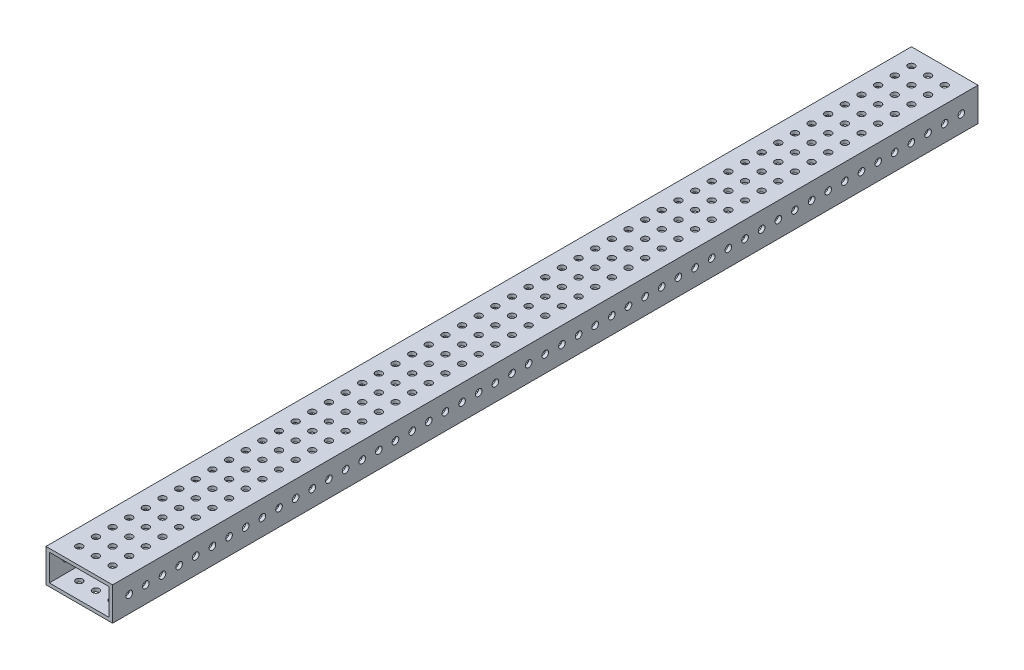
from build123d import *

# Parameters (mm, degrees)
SKETCH1_W           = 50.8
SKETCH1_H           = 25.4
SKETCH1_W_2         = 45.72
SKETCH1_H_2         = 20.32
BOSS_EXTRUDE1_DEPTH = 660.4
SKETCH2_R           = 2.54
CUT_EXTRUDE1_DEPTH  = 50.8
SKETCH3_R           = 2.54
CUT_EXTRUDE2_DEPTH  = 25.4


with BuildPart() as part:
    # Sketch1 → Boss-Extrude1 (new body)
    with BuildSketch(Plane.XY):
        with Locations((6.087936508, -2.60047619)):
            Rectangle(SKETCH1_W, SKETCH1_H)
        with Locations((6.087936508, -2.60047619)):
            Rectangle(SKETCH1_W_2, SKETCH1_H_2, mode=Mode.SUBTRACT)
    extrude(amount=BOSS_EXTRUDE1_DEPTH)

    # Sketch2 → Cut-Extrude1 (cut)
    with BuildSketch(Plane(origin=(31.487936508, 0, 0), x_dir=(0, 0, -1), z_dir=(1, 0, 0))):
        with Locations(Location((-647.7, -2.60047619, 0), (0, 0, 90))):
            Circle(SKETCH2_R)
        with Locations(Location((-635, -2.60047619, 0), (0, 0, 90))):
            Circle(SKETCH2_R)
        with Locations(Location((-622.3, -2.60047619, 0), (0, 0, 90))):
            Circle(SKETCH2_R)
        with Locations(Location((-609.6, -2.60047619, 0), (0, 0, 90))):
            Circle(SKETCH2_R)
        with Locations(Location((-596.9, -2.60047619, 0), (0, 0, 90))):
            Circle(SKETCH2_R)
        with Locations(Location((-584.2, -2.60047619, 0), (0, 0, 90))):
            Circle(SKETCH2_R)
        with Locations(Location((-571.5, -2.60047619, 0), (0, 0, 90))):
            Circle(SKETCH2_R)
        with Locations(Location((-558.8, -2.60047619, 0), (0, 0, 90))):
            Circle(SKETCH2_R)
        with Locations(Location((-546.1, -2.60047619, 0), (0, 0, 90))):
            Circle(SKETCH2_R)
        with Locations(Location((-533.4, -2.60047619, 0), (0, 0, 90))):
            Circle(SKETCH2_R)
        with Locations(Location((-520.7, -2.60047619, 0), (0, 0, 90))):
            Circle(SKETCH2_R)
        with Locations(Location((-508, -2.60047619, 0), (0, 0, 90))):
            Circle(SKETCH2_R)
        with Locations(Location((-495.3, -2.60047619, 0), (0, 0, 90))):
            Circle(SKETCH2_R)
        with Locations(Location((-482.6, -2.60047619, 0), (0, 0, 90))):
            Circle(SKETCH2_R)
        with Locations(Location((-469.9, -2.60047619, 0), (0, 0, 90))):
            Circle(SKETCH2_R)
        with Locations(Location((-457.2, -2.60047619, 0), (0, 0, 90))):
            Circle(SKETCH2_R)
        with Locations(Location((-444.5, -2.60047619, 0), (0, 0, 90))):
            Circle(SKETCH2_R)
        with Locations(Location((-431.8, -2.60047619, 0), (0, 0, 90))):
            Circle(SKETCH2_R)
        with Locations(Location((-419.1, -2.60047619, 0), (0, 0, 90))):
            Circle(SKETCH2_R)
        with Locations(Location((-406.4, -2.60047619, 0), (0, 0, 90))):
            Circle(SKETCH2_R)
        with Locations(Location((-393.7, -2.60047619, 0), (0, 0, 90))):
            Circle(SKETCH2_R)
        with Locations(Location((-381, -2.60047619, 0), (0, 0, 90))):
            Circle(SKETCH2_R)
        with Locations(Location((-368.3, -2.60047619, 0), (0, 0, 90))):
            Circle(SKETCH2_R)
        with Locations(Location((-355.6, -2.60047619, 0), (0, 0, 90))):
            Circle(SKETCH2_R)
        with Locations(Location((-342.9, -2.60047619, 0), (0, 0, 90))):
            Circle(SKETCH2_R)
        with Locations(Location((-330.2, -2.60047619, 0), (0, 0, 90))):
            Circle(SKETCH2_R)
        with Locations(Location((-317.5, -2.60047619, 0), (0, 0, 90))):
            Circle(SKETCH2_R)
        with Locations(Location((-304.8, -2.60047619, 0), (0, 0, 90))):
            Circle(SKETCH2_R)
        with Locations(Location((-292.1, -2.60047619, 0), (0, 0, 90))):
            Circle(SKETCH2_R)
        with Locations(Location((-279.4, -2.60047619, 0), (0, 0, 90))):
            Circle(SKETCH2_R)
        with Locations(Location((-266.7, -2.60047619, 0), (0, 0, 90))):
            Circle(SKETCH2_R)
        with Locations(Location((-254, -2.60047619, 0), (0, 0, 90))):
            Circle(SKETCH2_R)
        with Locations(Location((-241.3, -2.60047619, 0), (0, 0, 90))):
            Circle(SKETCH2_R)
        with Locations(Location((-228.6, -2.60047619, 0), (0, 0, 90))):
            Circle(SKETCH2_R)
        with Locations(Location((-215.9, -2.60047619, 0), (0, 0, 90))):
            Circle(SKETCH2_R)
        with Locations(Location((-203.2, -2.60047619, 0), (0, 0, 90))):
            Circle(SKETCH2_R)
        with Locations(Location((-190.5, -2.60047619, 0), (0, 0, 90))):
            Circle(SKETCH2_R)
        with Locations(Location((-177.8, -2.60047619, 0), (0, 0, 90))):
            Circle(SKETCH2_R)
        with Locations(Location((-165.1, -2.60047619, 0), (0, 0, 90))):
            Circle(SKETCH2_R)
        with Locations(Location((-152.4, -2.60047619, 0), (0, 0, 90))):
            Circle(SKETCH2_R)
        with Locations(Location((-139.7, -2.60047619, 0), (0, 0, 90))):
            Circle(SKETCH2_R)
        with Locations(Location((-127, -2.60047619, 0), (0, 0, 90))):
            Circle(SKETCH2_R)
        with Locations(Location((-114.3, -2.60047619, 0), (0, 0, 90))):
            Circle(SKETCH2_R)
        with Locations(Location((-101.6, -2.60047619, 0), (0, 0, 90))):
            Circle(SKETCH2_R)
        with Locations(Location((-88.9, -2.60047619, 0), (0, 0, 90))):
            Circle(SKETCH2_R)
        with Locations(Location((-76.2, -2.60047619, 0), (0, 0, 90))):
            Circle(SKETCH2_R)
        with Locations(Location((-63.5, -2.60047619, 0), (0, 0, 90))):
            Circle(SKETCH2_R)
        with Locations(Location((-50.8, -2.60047619, 0), (0, 0, 90))):
            Circle(SKETCH2_R)
        with Locations(Location((-38.1, -2.60047619, 0), (0, 0, 90))):
            Circle(SKETCH2_R)
        with Locations(Location((-25.4, -2.60047619, 0), (0, 0, 90))):
            Circle(SKETCH2_R)
        with Locations(Location((-12.7, -2.60047619, 0), (0, 0, 90))):
            Circle(SKETCH2_R)
    extrude(amount=-CUT_EXTRUDE1_DEPTH, mode=Mode.SUBTRACT)

    # Sketch3 → Cut-Extrude2 (cut)
    with BuildSketch(Plane(origin=(0, 10.09952381, 0), x_dir=(1, 0, 0), z_dir=(0, 1, 0))):
        with Locations(Location((-6.612063492, -647.7, 0), (0, 0, 270))):
            Circle(SKETCH3_R)
        with Locations(Location((6.087936508, -647.7, 0), (0, 0, 270))):
            Circle(SKETCH3_R)
        with Locations(Location((18.787936508, -647.7, 0), (0, 0, 270))):
            Circle(SKETCH3_R)
        with Locations(Location((6.087936508, -635, 0), (0, 0, 270))):
            Circle(SKETCH3_R)
        with Locations(Location((18.787936508, -635, 0), (0, 0, 270))):
            Circle(SKETCH3_R)
        with Locations(Location((6.087936508, -622.3, 0), (0, 0, 270))):
            Circle(SKETCH3_R)
        with Locations(Location((18.787936508, -622.3, 0), (0, 0, 270))):
            Circle(SKETCH3_R)
        with Locations(Location((6.087936508, -609.6, 0), (0, 0, 270))):
            Circle(SKETCH3_R)
        with Locations(Location((18.787936508, -609.6, 0), (0, 0, 270))):
            Circle(SKETCH3_R)
        with Locations(Location((6.087936508, -596.9, 0), (0, 0, 270))):
            Circle(SKETCH3_R)
        with Locations(Location((18.787936508, -596.9, 0), (0, 0, 270))):
            Circle(SKETCH3_R)
        with Locations(Location((6.087936508, -584.2, 0), (0, 0, 270))):
            Circle(SKETCH3_R)
        with Locations(Location((18.787936508, -584.2, 0), (0, 0, 270))):
            Circle(SKETCH3_R)
        with Locations(Location((6.087936508, -571.5, 0), (0, 0, 270))):
            Circle(SKETCH3_R)
        with Locations(Location((18.787936508, -571.5, 0), (0, 0, 270))):
            Circle(SKETCH3_R)
        with Locations(Location((6.087936508, -558.8, 0), (0, 0, 270))):
            Circle(SKETCH3_R)
        with Locations(Location((18.787936508, -558.8, 0), (0, 0, 270))):
            Circle(SKETCH3_R)
        with Locations(Location((6.087936508, -546.1, 0), (0, 0, 270))):
            Circle(SKETCH3_R)
        with Locations(Location((18.787936508, -546.1, 0), (0, 0, 270))):
            Circle(SKETCH3_R)
        with Locations(Location((6.087936508, -533.4, 0), (0, 0, 270))):
            Circle(SKETCH3_R)
        with Locations(Location((18.787936508, -533.4, 0), (0, 0, 270))):
            Circle(SKETCH3_R)
        with Locations(Location((6.087936508, -520.7, 0), (0, 0, 270))):
            Circle(SKETCH3_R)
        with Locations(Location((18.787936508, -520.7, 0), (0, 0, 270))):
            Circle(SKETCH3_R)
        with Locations(Location((6.087936508, -508, 0), (0, 0, 270))):
            Circle(SKETCH3_R)
        with Locations(Location((18.787936508, -508, 0), (0, 0, 270))):
            Circle(SKETCH3_R)
        with Locations(Location((6.087936508, -495.3, 0), (0, 0, 270))):
            Circle(SKETCH3_R)
        with Locations(Location((18.787936508, -495.3, 0), (0, 0, 270))):
            Circle(SKETCH3_R)
        with Locations(Location((6.087936508, -482.6, 0), (0, 0, 270))):
            Circle(SKETCH3_R)
        with Locations(Location((18.787936508, -482.6, 0), (0, 0, 270))):
            Circle(SKETCH3_R)
        with Locations(Location((6.087936508, -469.9, 0), (0, 0, 270))):
            Circle(SKETCH3_R)
        with Locations(Location((18.787936508, -469.9, 0), (0, 0, 270))):
            Circle(SKETCH3_R)
        with Locations(Location((6.087936508, -457.2, 0), (0, 0, 270))):
            Circle(SKETCH3_R)
        with Locations(Location((18.787936508, -457.2, 0), (0, 0, 270))):
            Circle(SKETCH3_R)
        with Locations(Location((6.087936508, -444.5, 0), (0, 0, 270))):
            Circle(SKETCH3_R)
        with Locations(Location((18.787936508, -444.5, 0), (0, 0, 270))):
            Circle(SKETCH3_R)
        with Locations(Location((6.087936508, -431.8, 0), (0, 0, 270))):
            Circle(SKETCH3_R)
        with Locations(Location((18.787936508, -431.8, 0), (0, 0, 270))):
            Circle(SKETCH3_R)
        with Locations(Location((6.087936508, -419.1, 0), (0, 0, 270))):
            Circle(SKETCH3_R)
        with Locations(Location((18.787936508, -419.1, 0), (0, 0, 270))):
            Circle(SKETCH3_R)
        with Locations(Location((6.087936508, -406.4, 0), (0, 0, 270))):
            Circle(SKETCH3_R)
        with Locations(Location((18.787936508, -406.4, 0), (0, 0, 270))):
            Circle(SKETCH3_R)
        with Locations(Location((6.087936508, -393.7, 0), (0, 0, 270))):
            Circle(SKETCH3_R)
        with Locations(Location((18.787936508, -393.7, 0), (0, 0, 270))):
            Circle(SKETCH3_R)
        with Locations(Location((6.087936508, -381, 0), (0, 0, 270))):
            Circle(SKETCH3_R)
        with Locations(Location((18.787936508, -381, 0), (0, 0, 270))):
            Circle(SKETCH3_R)
        with Locations(Location((6.087936508, -368.3, 0), (0, 0, 270))):
            Circle(SKETCH3_R)
        with Locations(Location((18.787936508, -368.3, 0), (0, 0, 270))):
            Circle(SKETCH3_R)
        with Locations(Location((6.087936508, -355.6, 0), (0, 0, 270))):
            Circle(SKETCH3_R)
        with Locations(Location((18.787936508, -355.6, 0), (0, 0, 270))):
            Circle(SKETCH3_R)
        with Locations(Location((6.087936508, -342.9, 0), (0, 0, 270))):
            Circle(SKETCH3_R)
        with Locations(Location((18.787936508, -342.9, 0), (0, 0, 270))):
            Circle(SKETCH3_R)
        with Locations(Location((6.087936508, -330.2, 0), (0, 0, 270))):
            Circle(SKETCH3_R)
        with Locations(Location((18.787936508, -330.2, 0), (0, 0, 270))):
            Circle(SKETCH3_R)
        with Locations(Location((6.087936508, -317.5, 0), (0, 0, 270))):
            Circle(SKETCH3_R)
        with Locations(Location((18.787936508, -317.5, 0), (0, 0, 270))):
            Circle(SKETCH3_R)
        with Locations(Location((6.087936508, -304.8, 0), (0, 0, 270))):
            Circle(SKETCH3_R)
        with Locations(Location((18.787936508, -304.8, 0), (0, 0, 270))):
            Circle(SKETCH3_R)
        with Locations(Location((6.087936508, -292.1, 0), (0, 0, 270))):
            Circle(SKETCH3_R)
        with Locations(Location((18.787936508, -292.1, 0), (0, 0, 270))):
            Circle(SKETCH3_R)
        with Locations(Location((6.087936508, -279.4, 0), (0, 0, 270))):
            Circle(SKETCH3_R)
        with Locations(Location((18.787936508, -279.4, 0), (0, 0, 270))):
            Circle(SKETCH3_R)
        with Locations(Location((6.087936508, -266.7, 0), (0, 0, 270))):
            Circle(SKETCH3_R)
        with Locations(Location((18.787936508, -266.7, 0), (0, 0, 270))):
            Circle(SKETCH3_R)
        with Locations(Location((6.087936508, -254, 0), (0, 0, 270))):
            Circle(SKETCH3_R)
        with Locations(Location((18.787936508, -254, 0), (0, 0, 270))):
            Circle(SKETCH3_R)
        with Locations(Location((6.087936508, -241.3, 0), (0, 0, 270))):
            Circle(SKETCH3_R)
        with Locations(Location((18.787936508, -241.3, 0), (0, 0, 270))):
            Circle(SKETCH3_R)
        with Locations(Location((6.087936508, -228.6, 0), (0, 0, 270))):
            Circle(SKETCH3_R)
        with Locations(Location((18.787936508, -228.6, 0), (0, 0, 270))):
            Circle(SKETCH3_R)
        with Locations(Location((6.087936508, -215.9, 0), (0, 0, 270))):
            Circle(SKETCH3_R)
        with Locations(Location((18.787936508, -215.9, 0), (0, 0, 270))):
            Circle(SKETCH3_R)
        with Locations(Location((6.087936508, -203.2, 0), (0, 0, 270))):
            Circle(SKETCH3_R)
        with Locations(Location((18.787936508, -203.2, 0), (0, 0, 270))):
            Circle(SKETCH3_R)
        with Locations(Location((6.087936508, -190.5, 0), (0, 0, 270))):
            Circle(SKETCH3_R)
        with Locations(Location((18.787936508, -190.5, 0), (0, 0, 270))):
            Circle(SKETCH3_R)
        with Locations(Location((6.087936508, -177.8, 0), (0, 0, 270))):
            Circle(SKETCH3_R)
        with Locations(Location((18.787936508, -177.8, 0), (0, 0, 270))):
            Circle(SKETCH3_R)
        with Locations(Location((6.087936508, -165.1, 0), (0, 0, 270))):
            Circle(SKETCH3_R)
        with Locations(Location((18.787936508, -165.1, 0), (0, 0, 270))):
            Circle(SKETCH3_R)
        with Locations(Location((6.087936508, -152.4, 0), (0, 0, 270))):
            Circle(SKETCH3_R)
        with Locations(Location((18.787936508, -152.4, 0), (0, 0, 270))):
            Circle(SKETCH3_R)
        with Locations(Location((6.087936508, -139.7, 0), (0, 0, 270))):
            Circle(SKETCH3_R)
        with Locations(Location((18.787936508, -139.7, 0), (0, 0, 270))):
            Circle(SKETCH3_R)
        with Locations(Location((6.087936508, -127, 0), (0, 0, 270))):
            Circle(SKETCH3_R)
        with Locations(Location((18.787936508, -127, 0), (0, 0, 270))):
            Circle(SKETCH3_R)
        with Locations(Location((6.087936508, -114.3, 0), (0, 0, 270))):
            Circle(SKETCH3_R)
        with Locations(Location((18.787936508, -114.3, 0), (0, 0, 270))):
            Circle(SKETCH3_R)
        with Locations(Location((6.087936508, -101.6, 0), (0, 0, 270))):
            Circle(SKETCH3_R)
        with Locations(Location((18.787936508, -101.6, 0), (0, 0, 270))):
            Circle(SKETCH3_R)
        with Locations(Location((6.087936508, -88.9, 0), (0, 0, 270))):
            Circle(SKETCH3_R)
        with Locations(Location((18.787936508, -88.9, 0), (0, 0, 270))):
            Circle(SKETCH3_R)
        with Locations(Location((6.087936508, -76.2, 0), (0, 0, 270))):
            Circle(SKETCH3_R)
        with Locations(Location((18.787936508, -76.2, 0), (0, 0, 270))):
            Circle(SKETCH3_R)
        with Locations(Location((6.087936508, -63.5, 0), (0, 0, 270))):
            Circle(SKETCH3_R)
        with Locations(Location((18.787936508, -63.5, 0), (0, 0, 270))):
            Circle(SKETCH3_R)
        with Locations(Location((6.087936508, -50.8, 0), (0, 0, 270))):
            Circle(SKETCH3_R)
        with Locations(Location((18.787936508, -50.8, 0), (0, 0, 270))):
            Circle(SKETCH3_R)
        with Locations(Location((6.087936508, -38.1, 0), (0, 0, 270))):
            Circle(SKETCH3_R)
        with Locations(Location((18.787936508, -38.1, 0), (0, 0, 270))):
            Circle(SKETCH3_R)
        with Locations(Location((6.087936508, -25.4, 0), (0, 0, 270))):
            Circle(SKETCH3_R)
        with Locations(Location((18.787936508, -25.4, 0), (0, 0, 270))):
            Circle(SKETCH3_R)
        with Locations(Location((6.087936508, -12.7, 0), (0, 0, 270))):
            Circle(SKETCH3_R)
        with Locations(Location((18.787936508, -12.7, 0), (0, 0, 270))):
            Circle(SKETCH3_R)
        with Locations(Location((-6.612063492, -635, 0), (0, 0, 270))):
            Circle(SKETCH3_R)
        with Locations(Location((-6.612063492, -622.3, 0), (0, 0, 270))):
            Circle(SKETCH3_R)
        with Locations(Location((-6.612063492, -609.6, 0), (0, 0, 270))):
            Circle(SKETCH3_R)
        with Locations(Location((-6.612063492, -596.9, 0), (0, 0, 270))):
            Circle(SKETCH3_R)
        with Locations(Location((-6.612063492, -584.2, 0), (0, 0, 270))):
            Circle(SKETCH3_R)
        with Locations(Location((-6.612063492, -571.5, 0), (0, 0, 270))):
            Circle(SKETCH3_R)
        with Locations(Location((-6.612063492, -558.8, 0), (0, 0, 270))):
            Circle(SKETCH3_R)
        with Locations(Location((-6.612063492, -546.1, 0), (0, 0, 270))):
            Circle(SKETCH3_R)
        with Locations(Location((-6.612063492, -533.4, 0), (0, 0, 270))):
            Circle(SKETCH3_R)
        with Locations(Location((-6.612063492, -520.7, 0), (0, 0, 270))):
            Circle(SKETCH3_R)
        with Locations(Location((-6.612063492, -508, 0), (0, 0, 270))):
            Circle(SKETCH3_R)
        with Locations(Location((-6.612063492, -495.3, 0), (0, 0, 270))):
            Circle(SKETCH3_R)
        with Locations(Location((-6.612063492, -482.6, 0), (0, 0, 270))):
            Circle(SKETCH3_R)
        with Locations(Location((-6.612063492, -469.9, 0), (0, 0, 270))):
            Circle(SKETCH3_R)
        with Locations(Location((-6.612063492, -457.2, 0), (0, 0, 270))):
            Circle(SKETCH3_R)
        with Locations(Location((-6.612063492, -444.5, 0), (0, 0, 270))):
            Circle(SKETCH3_R)
        with Locations(Location((-6.612063492, -431.8, 0), (0, 0, 270))):
            Circle(SKETCH3_R)
        with Locations(Location((-6.612063492, -419.1, 0), (0, 0, 270))):
            Circle(SKETCH3_R)
        with Locations(Location((-6.612063492, -406.4, 0), (0, 0, 270))):
            Circle(SKETCH3_R)
        with Locations(Location((-6.612063492, -393.7, 0), (0, 0, 270))):
            Circle(SKETCH3_R)
        with Locations(Location((-6.612063492, -381, 0), (0, 0, 270))):
            Circle(SKETCH3_R)
        with Locations(Location((-6.612063492, -368.3, 0), (0, 0, 270))):
            Circle(SKETCH3_R)
        with Locations(Location((-6.612063492, -355.6, 0), (0, 0, 270))):
            Circle(SKETCH3_R)
        with Locations(Location((-6.612063492, -342.9, 0), (0, 0, 270))):
            Circle(SKETCH3_R)
        with Locations(Location((-6.612063492, -330.2, 0), (0, 0, 270))):
            Circle(SKETCH3_R)
        with Locations(Location((-6.612063492, -317.5, 0), (0, 0, 270))):
            Circle(SKETCH3_R)
        with Locations(Location((-6.612063492, -304.8, 0), (0, 0, 270))):
            Circle(SKETCH3_R)
        with Locations(Location((-6.612063492, -292.1, 0), (0, 0, 270))):
            Circle(SKETCH3_R)
        with Locations(Location((-6.612063492, -279.4, 0), (0, 0, 270))):
            Circle(SKETCH3_R)
        with Locations(Location((-6.612063492, -266.7, 0), (0, 0, 270))):
            Circle(SKETCH3_R)
        with Locations(Location((-6.612063492, -254, 0), (0, 0, 270))):
            Circle(SKETCH3_R)
        with Locations(Location((-6.612063492, -241.3, 0), (0, 0, 270))):
            Circle(SKETCH3_R)
        with Locations(Location((-6.612063492, -228.6, 0), (0, 0, 270))):
            Circle(SKETCH3_R)
        with Locations(Location((-6.612063492, -215.9, 0), (0, 0, 270))):
            Circle(SKETCH3_R)
        with Locations(Location((-6.612063492, -203.2, 0), (0, 0, 270))):
            Circle(SKETCH3_R)
        with Locations(Location((-6.612063492, -190.5, 0), (0, 0, 270))):
            Circle(SKETCH3_R)
        with Locations(Location((-6.612063492, -177.8, 0), (0, 0, 270))):
            Circle(SKETCH3_R)
        with Locations(Location((-6.612063492, -165.1, 0), (0, 0, 270))):
            Circle(SKETCH3_R)
        with Locations(Location((-6.612063492, -152.4, 0), (0, 0, 270))):
            Circle(SKETCH3_R)
        with Locations(Location((-6.612063492, -139.7, 0), (0, 0, 270))):
            Circle(SKETCH3_R)
        with Locations(Location((-6.612063492, -127, 0), (0, 0, 270))):
            Circle(SKETCH3_R)
        with Locations(Location((-6.612063492, -114.3, 0), (0, 0, 270))):
            Circle(SKETCH3_R)
        with Locations(Location((-6.612063492, -101.6, 0), (0, 0, 270))):
            Circle(SKETCH3_R)
        with Locations(Location((-6.612063492, -88.9, 0), (0, 0, 270))):
            Circle(SKETCH3_R)
        with Locations(Location((-6.612063492, -76.2, 0), (0, 0, 270))):
            Circle(SKETCH3_R)
        with Locations(Location((-6.612063492, -63.5, 0), (0, 0, 270))):
            Circle(SKETCH3_R)
        with Locations(Location((-6.612063492, -50.8, 0), (0, 0, 270))):
            Circle(SKETCH3_R)
        with Locations(Location((-6.612063492, -38.1, 0), (0, 0, 270))):
            Circle(SKETCH3_R)
        with Locations(Location((-6.612063492, -25.4, 0), (0, 0, 270))):
            Circle(SKETCH3_R)
        with Locations(Location((-6.612063492, -12.7, 0), (0, 0, 270))):
            Circle(SKETCH3_R)
    extrude(amount=-CUT_EXTRUDE2_DEPTH, mode=Mode.SUBTRACT)


solid = part.part
